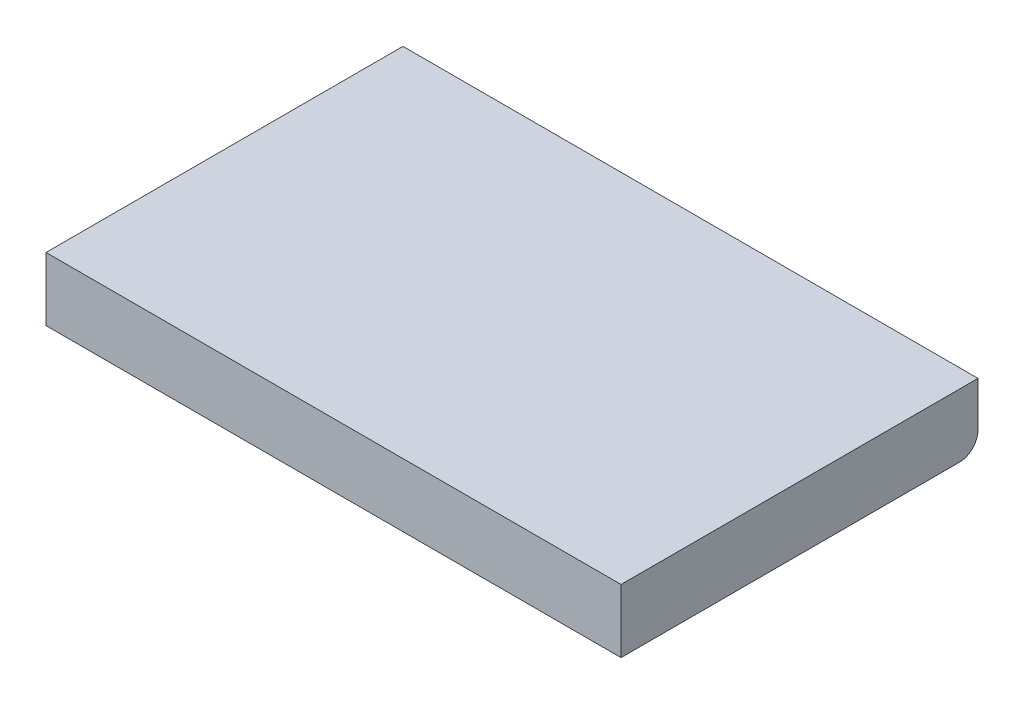
from build123d import *

# Parameters (mm, degrees)
IZIM1_W                     = 158.200000084
IZIM1_H                     = 98.199999942
Y_KSEKLIK_EKSTR_ZYON1_DEPTH = 6.35
Y_KSEKLIK_EKSTR_ZYON2_DEPTH = 34.142000042
Y_KSEKLIK_EKSTR_ZYON3_DEPTH = 34.650000042
IZIM5_R                     = 1.651
KES_EKSTR_ZYON1_DEPTH       = 38.1
IZIM6_R                     = 1.651
KES_EKSTR_ZYON2_DEPTH       = 34.142000042
IZIM7_W                     = 98.200002037
IZIM7_H                     = 11.08
Y_KSEKLIK_EKSTR_ZYON4_DEPTH = 6.35
IZIM10_W                    = 98.200002037
IZIM10_H                    = 11.08
Y_KSEKLIK_EKSTR_ZYON5_DEPTH = 6.35
IZIM12_W                    = 145.500000084
IZIM12_H                    = 11.08
Y_KSEKLIK_EKSTR_ZYON6_DEPTH = 6.35
RADYUS1_R                   = 5.08
RADYUS2_R                   = 5.08
IZIM15_R                    = 1.651
KES_EKSTR_ZYON3_DEPTH       = 6.35


with BuildPart() as part:
    # Çizim1 → Yükseklik-Ekstrüzyon1 (new body)
    with BuildSketch(Plane(origin=(0, 0, 0), x_dir=(1, 0, 0), z_dir=(0, 1, 0))):
        Rectangle(IZIM1_W, IZIM1_H)
    extrude(amount=Y_KSEKLIK_EKSTR_ZYON1_DEPTH)

    # Çizim2 → Yükseklik-Ekstrüzyon2 (add)
    with BuildSketch(Plane(origin=(-47.096000042, 0, 0), x_dir=(0, 0, -1), z_dir=(1, 0, 0))):
        with BuildLine():
            Line((49.100004162, 4.89e-07), (42.750004162, 4.89e-07))
            Line((42.750004162, 4.89e-07), (42.750004162, -2.799659899))
            ThreePointArc((42.750004162, -2.799659899), (45.925004162, -9.728237327), (49.100004162, -2.799659899))
            Line((49.100004162, -2.799659899), (49.100004162, 4.89e-07))
        make_face()
    extrude(amount=Y_KSEKLIK_EKSTR_ZYON2_DEPTH)


with BuildPart() as y_kseklik_ekstr_zyon3_tool:
    # Çizim3 → Yükseklik-Ekstrüzyon3 (new body)
    with BuildSketch(Plane.ZY.offset(-47.096000042)):
        with BuildLine():
            Line((-42.749997505, -7.075e-06), (-49.099997505, -7.075e-06))
            Line((-49.099997505, -7.075e-06), (-49.099997505, -2.799667463))
            ThreePointArc((-49.099997505, -2.799667463), (-45.924997505, -9.728244892), (-42.749997505, -2.799667463))
            Line((-42.749997505, -2.799667463), (-42.749997505, -7.075e-06))
        make_face()
    extrude(amount=Y_KSEKLIK_EKSTR_ZYON3_DEPTH)


with BuildPart() as part_1:
    add(part.part)


with BuildPart() as part_2:
    # Yükseklik-Ekstrüzyon3: joined with y_kseklik_ekstr_zyon3_tool
    add(part_1.part.fuse(y_kseklik_ekstr_zyon3_tool.part, tol=0.00001))

    # Çizim5 → Kes-Ekstrüzyon1 (cut)
    with BuildSketch(Plane(origin=(47.096000042, 0, 0), x_dir=(0, 0, -1), z_dir=(1, 0, 0))):
        with Locations((45.924997505, -5.536489024)):
            Circle(IZIM5_R)
    extrude(amount=-KES_EKSTR_ZYON1_DEPTH, mode=Mode.SUBTRACT)

    # Çizim6 → Kes-Ekstrüzyon2 (cut)
    with BuildSketch(Plane.ZY.offset(47.096000042)):
        with Locations((-45.925004162, -5.536481459)):
            Circle(IZIM6_R)
    extrude(amount=-KES_EKSTR_ZYON2_DEPTH, mode=Mode.SUBTRACT)

    # Çizim7 → Yükseklik-Ekstrüzyon4 (add)
    with BuildSketch(Plane.ZY.offset(79.100000042)):
        with Locations((-1.047e-06, -5.54)):
            Rectangle(IZIM7_W, IZIM7_H)
    extrude(amount=-Y_KSEKLIK_EKSTR_ZYON4_DEPTH)

    # Çizim10 → Yükseklik-Ekstrüzyon5 (add)
    with BuildSketch(Plane(origin=(79.100000042, 0, 0), x_dir=(0, 0, -1), z_dir=(1, 0, 0))):
        with Locations((1.047e-06, -5.54)):
            Rectangle(IZIM10_W, IZIM10_H)
    extrude(amount=-Y_KSEKLIK_EKSTR_ZYON5_DEPTH)

    # Çizim12 → Yükseklik-Ekstrüzyon6 (add)
    with BuildSketch(Plane.XY.offset(49.099999971)):
        with Locations((0, -5.54)):
            Rectangle(IZIM12_W, IZIM12_H)
    extrude(amount=-Y_KSEKLIK_EKSTR_ZYON6_DEPTH)

    # Radyus1
    radyus1_edges = [part_2.edges().sort_by_distance(p)[0] for p in [
        (75.925000042, -11.08, -49.100002066),
    ]]
    fillet(radyus1_edges, radius=RADYUS1_R)

    # Radyus2
    radyus2_edges = [part_2.edges().sort_by_distance(p)[0] for p in [
        (-75.925000042, -11.08, -49.100002066),
    ]]
    fillet(radyus2_edges, radius=RADYUS2_R)

    # Çizim15 → Kes-Ekstrüzyon3 (cut)
    with BuildSketch(Plane.ZY.offset(79.100000042)):
        with Locations((-45.925004162, -5.536481459)):
            Circle(IZIM15_R)
    extrude(amount=-KES_EKSTR_ZYON3_DEPTH, mode=Mode.SUBTRACT)


solid = part_2.part
